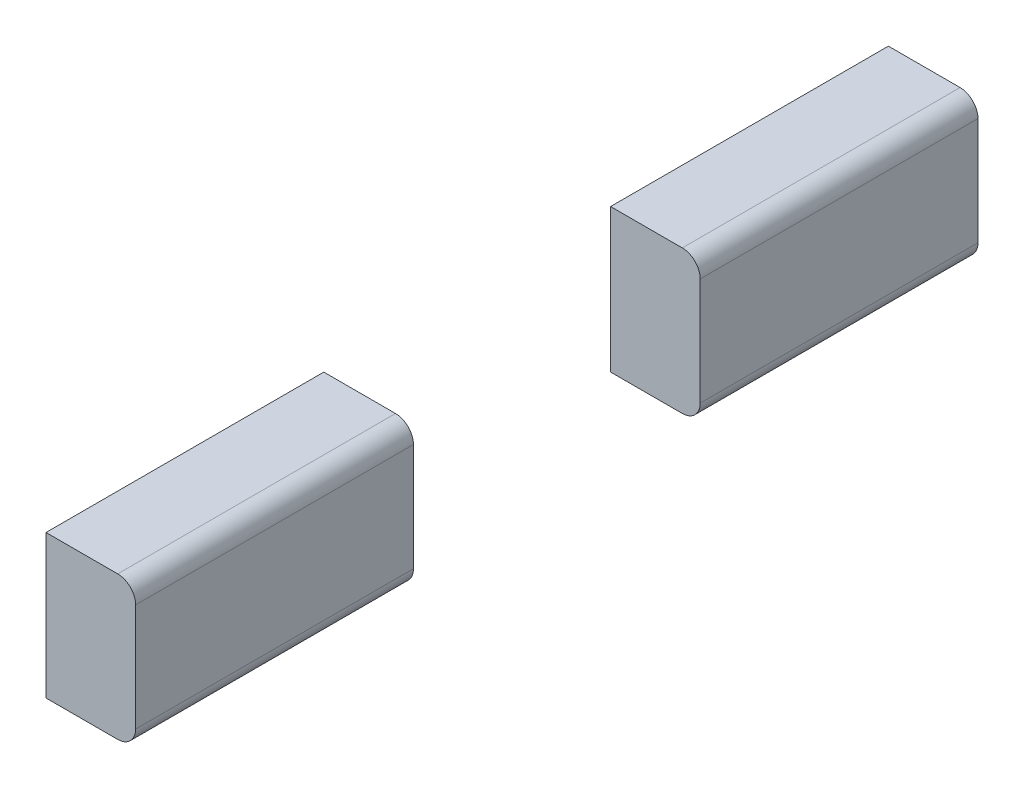
from build123d import *

# Parameters (mm, degrees)
SKETCH1_W           = 63.5
SKETCH1_H           = 101.6
BOSS_EXTRUDE1_DEPTH = 596.9
FILLET1_R           = 12.7
SKETCH2_W           = 203.2
SKETCH2_H           = 101.6
CUT_EXTRUDE1_DEPTH  = 609.805732562


with BuildPart() as part:
    # Sketch1 → Boss-Extrude1 (new body)
    with BuildSketch(Plane.XY):
        with Locations((31.75, 50.8)):
            Rectangle(SKETCH1_W, SKETCH1_H)
    extrude(amount=BOSS_EXTRUDE1_DEPTH)

    # Fillet1
    fillet1_edges = [part.edges().sort_by_distance(p)[0] for p in [
        (63.5, 101.6, 298.45),
        (63.5, 0, 298.45),
    ]]
    fillet(fillet1_edges, radius=FILLET1_R)

    # Sketch2 → Cut-Extrude1 (cut, through all)
    with BuildSketch(Plane(origin=(63.5, 0, 0), x_dir=(0, 0, -1), z_dir=(1, 0, 0))):
        with Locations((-298.45, 50.8)):
            Rectangle(SKETCH2_W, SKETCH2_H)
    extrude(amount=-CUT_EXTRUDE1_DEPTH, mode=Mode.SUBTRACT)


with BuildPart() as cut_extrude1_piece_1:
    # of the separate pieces the step leaves, piece 1, a body of its own (cut_extrude1_pieces)
    add(part.part.solids().sort_by_distance((50.8, 101.6, 400.05))[0])


with BuildPart() as cut_extrude1_piece_2:
    # of the separate pieces the step leaves, piece 2, a body of its own (cut_extrude1_pieces)
    add(part.part.solids().sort_by_distance((50.8, 101.6, 0))[0])


solid = Compound([cut_extrude1_piece_1.part, cut_extrude1_piece_2.part])
